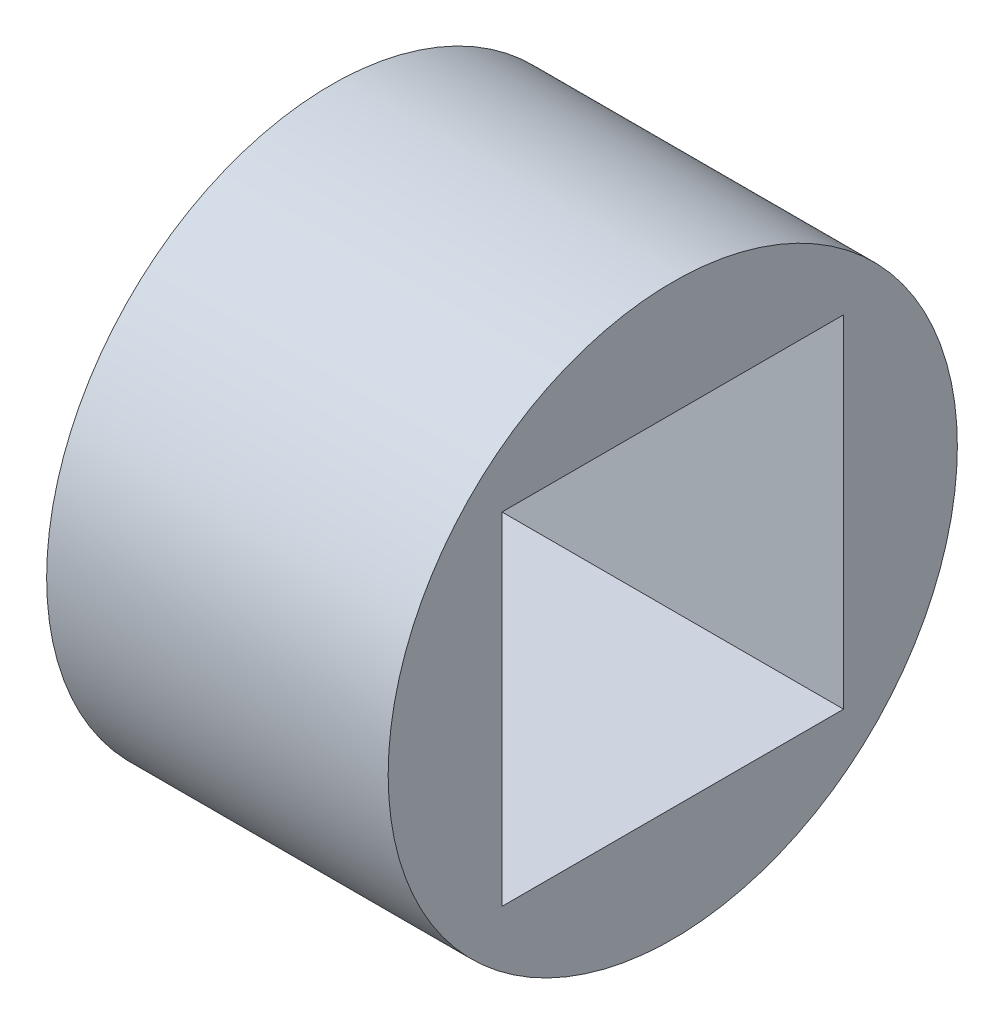
from build123d import *

# Parameters (mm, degrees)
SKETCH1_R           = 2.5
SKETCH1_W           = 3
SKETCH1_H           = 3
BOSS_EXTRUDE1_DEPTH = 3


with BuildPart() as part:
    # Sketch1 → Boss-Extrude1 (new body)
    with BuildSketch(Plane(origin=(0, 0, 0), x_dir=(0, 0, -1), z_dir=(1, 0, 0))):
        Circle(SKETCH1_R)
        Rectangle(SKETCH1_W, SKETCH1_H, mode=Mode.SUBTRACT)
    extrude(amount=BOSS_EXTRUDE1_DEPTH)


solid = part.part
